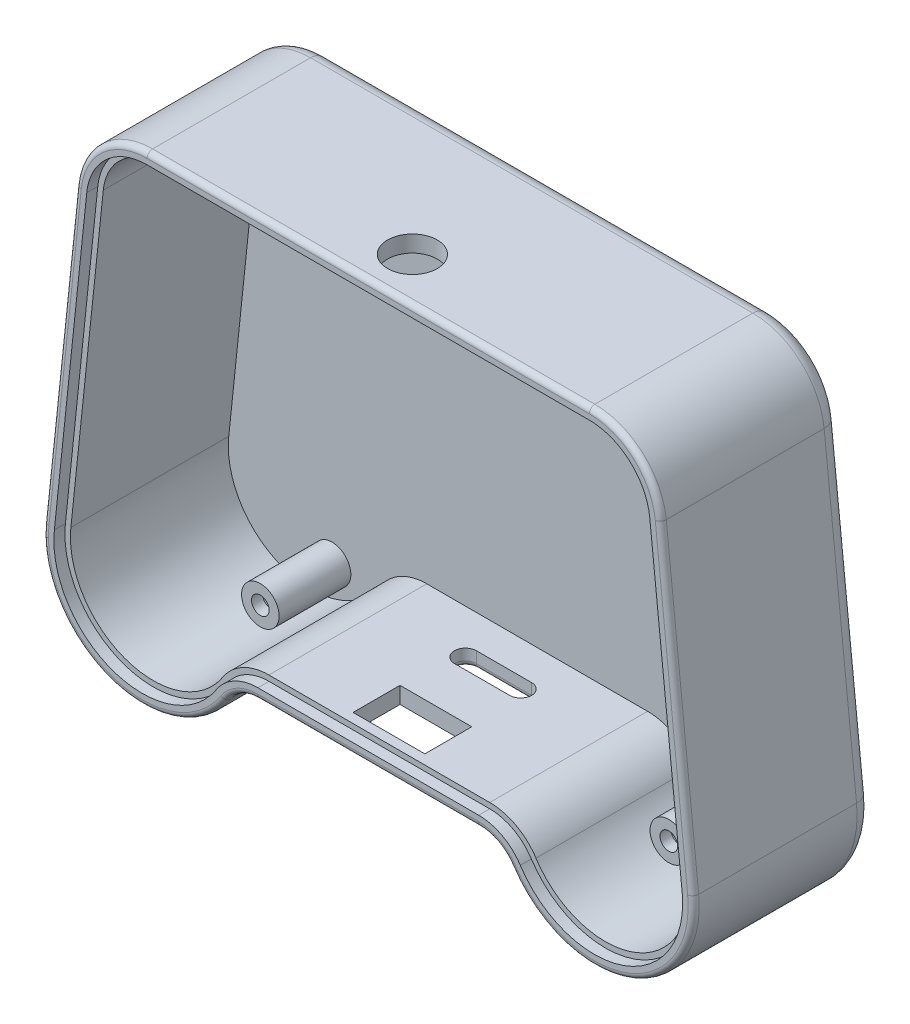
from build123d import *

# Parameters (mm, degrees)
BOSS_EXTRUDE3_DEPTH     = 32.6
CUT_EXTRUDE3_DEPTH      = 2
CUT_EXTRUDE4_DEPTH      = 28.6
FILLET3_R               = 3
SKETCH4_R               = 3.5
BOSS_EXTRUDE4_DEPTH     = 13
SKETCH6_R               = 4.5
CUT_EXTRUDE5_DEPTH      = 13
CUT_EXTRUDE6_DEPTH      = 13
SKETCH12_R              = 1.4
CUT_EXTRUDE7_DEPTH      = 13
SKETCH14_R              = 3.4
BOSS_EXTRUDE6_DEPTH     = 13
SKETCH15_R              = 1.6
CUT_EXTRUDE8_DEPTH      = 14
CUT_EXTRUDE9_DEPTH      = 11
CUT_EXTRUDE9_DEPTH_BACK = 12
SKETCH16_R              = 2.7
SKETCH17_W              = 13
SKETCH17_H              = 8.5
CUT_EXTRUDE10_DEPTH     = 3
FILLET8_R               = 1
FILLET10_R              = 1


with BuildPart() as part:
    # Sketch1 → Boss-Extrude3 (new body)
    with BuildSketch(Plane.XY):
        with BuildLine():
            Line((-52.983565686, 23.39887956), (-58.852264413, -32.438059002))
            ThreePointArc((-58.852264413, -32.438059002), (-46.969286951, -51.283611573), (-25.866243683, -44.140673109))
            ThreePointArc((-25.866243683, -44.140673109), (-23.336523529, -41.806324016), (-20, -40.959990463))
            Line((-20, -40.959990463), (20, -40.959990463))
            ThreePointArc((20, -40.959990463), (23.336523529, -41.806324016), (25.866243683, -44.140673109))
            ThreePointArc((25.866243683, -44.140673109), (46.969286951, -51.283611573), (58.852264413, -32.438059002))
            Line((58.852264413, -32.438059002), (52.983565686, 23.39887956))
            ThreePointArc((52.983565686, 23.39887956), (48.753478929, 31.700892268), (40.054781046, 35.040009537))
            Line((40.054781046, 35.040009537), (-40.054781046, 35.040009537))
            ThreePointArc((-40.054781046, 35.040009537), (-48.753478929, 31.700892268), (-52.983565686, 23.39887956))
        make_face()
    extrude(amount=BOSS_EXTRUDE3_DEPTH)

    # 3DSketch4 → Cut-Extrude3 (cut)
    with BuildSketch(Plane(origin=(40.054781046, 33.040009537, 32.6), x_dir=(-0.7683409363755422, -0.6400407842392195, 0), z_dir=(0, 0, 1))):
        with BuildLine():
            Line((0, 0), (61.551455951, -51.273386947))
            add(Edge.make_bspline(
                [(61.551455951, -51.273386947), (61.588680024, -51.304395219), (61.625904097, -51.335403491), (61.663212744, -51.36630816), (61.83731755, -51.508914621), (62.016897971, -51.644813478), (62.160582396, -51.747925732), (62.55807944, -52.020977095), (62.966999087, -52.276660424), (63.230647039, -52.430511499), (63.838045632, -52.757891972), (64.471528972, -53.033315493), (64.831797516, -53.170851401), (65.563673976, -53.413845335), (66.313334814, -53.592940824), (66.691732278, -53.666220369), (67.453903197, -53.779655887), (68.223309902, -53.82566991), (68.608795977, -53.831816819), (69.379281124, -53.810380979), (70.144687368, -53.721466908), (70.525232677, -53.660359002), (71.280231496, -53.505278822), (72.019494368, -53.285344651), (72.383971709, -53.159224039), (73.100177988, -52.8747957), (73.786007028, -52.526233015), (74.121547561, -52.3373849), (74.668859007, -52.000804779), (75.196911166, -51.631910372), (75.403368477, -51.478016949), (75.703386012, -51.235925261), (75.98511625, -50.974334149), (76.077671715, -50.88569271), (76.169549872, -50.79632907), (76.26142803, -50.70696543)],
                knots=[0, 0, 0, 0, 0, 0, 0.015039156, 0.015039156, 0.015039156, 0.069865084, 0.069865084, 0.069865084, 0.164477785, 0.164477785, 0.164477785, 0.283838101, 0.283838101, 0.283838101, 0.403198418, 0.403198418, 0.403198418, 0.522558734, 0.522558734, 0.522558734, 0.641919051, 0.641919051, 0.641919051, 0.761279367, 0.761279367, 0.761279367, 0.880639684, 0.880639684, 0.880639684, 0.960213228, 0.960213228, 0.960213228, 1, 1, 1, 1, 1, 1], degree=5))
            Line((76.26142803, -50.70696543), (116.508507452, -11.561366307))
            add(Edge.make_bspline(
                [(116.508507452, -11.561366307), (116.642148408, -11.43138283), (116.775789364, -11.301399354), (116.908407575, -11.170401944), (117.300125738, -10.771326116), (117.664229786, -10.344874086), (117.896319562, -10.050898179), (118.453995066, -9.298003634), (118.965465003, -8.515801185), (119.253588228, -8.035549949), (119.788067731, -7.052430105), (120.230514408, -6.022559834), (120.428596315, -5.497706496), (120.778210816, -4.431702221), (121.03419379, -3.340180362), (121.138411668, -2.789330645), (121.298568751, -1.680034852), (121.36070558, -0.560708776), (121.367278883, 0), (121.331455173, 1.120585364), (121.197730642, 2.233659019), (121.106618538, 2.786914222), (120.876345388, 3.884053984), (120.55087582, 4.956837669), (120.364818666, 5.485788432), (119.947013086, 6.526103678), (119.4397319, 7.525838124), (119.164424557, 8.014313828), (118.571880673, 8.965989554), (117.898286997, 9.86212864), (117.542136544, 10.295209684), (116.792946072, 11.129186098), (115.973611798, 11.894373807), (115.547496998, 12.258836381), (114.664548651, 12.949630758), (113.724515961, 13.560427174), (113.24145817, 13.845114311), (112.251718979, 14.371643284), (111.21965113, 14.809635332), (110.694387374, 15.005940261), (109.628104868, 15.352054202), (108.535721707, 15.602948853), (107.984367929, 15.704540642), (106.874061909, 15.859911713), (105.754010824, 15.919454913), (105.193145081, 15.924478387), (104.212429665, 15.888556551), (103.238924733, 15.771911626), (102.823045609, 15.708477515), (102.178914225, 15.591143717), (101.540229972, 15.448316527), (101.313051664, 15.393089045), (101.041764738, 15.320570772), (100.77310042, 15.23932356), (100.728039001, 15.225517494), (100.683002229, 15.211629397), (100.637965456, 15.1977413)],
                knots=[0, 0, 0, 0, 0, 0, 0.021853908, 0.021853908, 0.021853908, 0.065561725, 0.065561725, 0.065561725, 0.131123449, 0.131123449, 0.131123449, 0.196685174, 0.196685174, 0.196685174, 0.262246898, 0.262246898, 0.262246898, 0.327808623, 0.327808623, 0.327808623, 0.393370347, 0.393370347, 0.393370347, 0.458932072, 0.458932072, 0.458932072, 0.524493797, 0.524493797, 0.524493797, 0.590055521, 0.590055521, 0.590055521, 0.655617246, 0.655617246, 0.655617246, 0.72117897, 0.72117897, 0.72117897, 0.786740695, 0.786740695, 0.786740695, 0.852302419, 0.852302419, 0.852302419, 0.917864144, 0.917864144, 0.917864144, 0.967096671, 0.967096671, 0.967096671, 0.994475289, 0.994475289, 0.994475289, 1, 1, 1, 1, 1, 1], degree=5))
            add(Edge.make_bspline(
                [(100.637965456, 15.1977413), (100.569964202, 15.176771591), (100.501962948, 15.155801882), (100.433859748, 15.135181173), (100.196585264, 15.065976794), (99.9556205, 15.009405765), (99.782629052, 14.974530224), (99.33119816, 14.895457118), (98.876764512, 14.839400864), (98.596567776, 14.8146417), (98.001430001, 14.78484619), (97.405271571, 14.807669193), (97.09088395, 14.833932957), (96.464930297, 14.913914197), (95.848011145, 15.046884805), (95.542779817, 15.126741261), (94.940712904, 15.313444095), (94.359315967, 15.554622011), (94.0737058, 15.687592439), (93.606037367, 15.927783438), (93.152063142, 16.195493524), (92.97396226, 16.308040708), (92.713990752, 16.486646356), (92.467357228, 16.682593901), (92.385936541, 16.749373435), (92.305020688, 16.816782184), (92.224102671, 16.884188238), (92.223757547, 16.884475732)],
                knots=[0, 0, 0, 0, 0, 0, 0.03982324, 0.03982324, 0.03982324, 0.13833174, 0.13833174, 0.13833174, 0.295525501, 0.295525501, 0.295525501, 0.471581283, 0.471581283, 0.471581283, 0.647637065, 0.647637065, 0.647637065, 0.823692847, 0.823692847, 0.823692847, 0.941063368, 0.941063368, 0.941063368, 0.999748629, 1, 1, 1, 1, 1, 1], degree=5))
            Line((92.223757547, 16.884475732), (61.491845713, 42.48466963))
            add(Edge.make_bspline(
                [(61.491845713, 42.48466963), (61.411272821, 42.55178819), (61.330699929, 42.61890675), (61.250656963, 42.686638176), (61.013707622, 42.893509657), (60.791066284, 43.11692854), (60.648189687, 43.271760936), (60.302855218, 43.669888292), (59.982112363, 44.086457014), (59.799722254, 44.343338602), (59.457458489, 44.87158542), (59.165038122, 45.430005374), (59.031342223, 45.715782601), (58.789085864, 46.298519489), (58.597314126, 46.899717105), (58.514674232, 47.204183867), (58.384503718, 47.78640496), (58.306269995, 48.377130132), (58.279991286, 48.657188441), (58.253010647, 49.114270807), (58.249210565, 49.572558888), (58.252253231, 49.749004593), (58.264351778, 49.996224988), (58.289553171, 50.242202441), (58.297541785, 50.313014197), (58.30589154, 50.383788806), (58.314240768, 50.454563468), (58.314252994, 50.454667106)],
                knots=[0, 0, 0, 0, 0, 0, 0.058696587, 0.058696587, 0.058696587, 0.176089762, 0.176089762, 0.176089762, 0.352179524, 0.352179524, 0.352179524, 0.528269287, 0.528269287, 0.528269287, 0.704359049, 0.704359049, 0.704359049, 0.861583149, 0.861583149, 0.861583149, 0.960110663, 0.960110663, 0.960110663, 0.999941589, 1, 1, 1, 1, 1, 1], degree=5))
            add(Edge.make_bspline(
                [(58.314252994, 50.454667106), (58.319762306, 50.501368411), (58.325271054, 50.54806978), (58.33069467, 50.594780565), (58.362042992, 50.873600104), (58.384338903, 51.153421054), (58.397607171, 51.38683916), (58.422675866, 52.040818319), (58.421686541, 52.695548402), (58.408928945, 53.116044034), (58.347745738, 54.094601394), (58.205865317, 55.06566424), (58.09957857, 55.616389892), (57.838627215, 56.707244701), (57.485186295, 57.771199186), (57.285639607, 58.295119981), (56.841486096, 59.324185943), (56.308396966, 60.310375186), (56.020410555, 60.791521177), (55.403138155, 61.727457), (54.706434832, 62.605762702), (54.339147497, 63.029427202), (53.568545598, 63.843617863), (52.729577466, 64.587208563), (52.29411722, 64.940452338), (51.393475122, 65.608033565), (50.437851321, 66.194195807), (49.947544377, 66.466227858), (48.944441167, 66.966805176), (47.901360842, 67.377631632), (47.37117908, 67.560141755), (46.296237718, 67.878425017), (45.197551402, 68.101372752), (44.643687953, 68.188788163), (43.52975237, 68.315052919), (42.409063204, 68.343287244), (41.848451541, 68.332928784), (40.729536679, 68.263324585), (39.620924005, 68.096073771), (39.070632783, 67.988291068), (37.980959705, 67.724919785), (36.91886363, 67.366954179), (36.395913122, 67.16491571), (35.368613721, 66.715913268), (34.383330665, 66.179431476), (33.902909427, 65.889771499), (32.969939942, 65.26851489), (32.099581252, 64.565187996), (31.679297993, 64.195028268), (31.002391684, 63.550637069), (30.362659987, 62.866096698), (30.115460795, 62.584707186), (29.761820558, 62.149538628), (29.440095632, 61.692157268), (29.334678033, 61.537257872), (29.230454656, 61.381527307), (29.126225192, 61.225800978), (29.125691224, 61.225003192), (29.125157256, 61.224205405)],
                knots=[0, 0, 0, 0, 0, 0, 0.005511925, 0.005511925, 0.005511925, 0.032887797, 0.032887797, 0.032887797, 0.082115387, 0.082115387, 0.082115387, 0.147670536, 0.147670536, 0.147670536, 0.213225685, 0.213225685, 0.213225685, 0.278780835, 0.278780835, 0.278780835, 0.344335984, 0.344335984, 0.344335984, 0.409891133, 0.409891133, 0.409891133, 0.475446283, 0.475446283, 0.475446283, 0.541001432, 0.541001432, 0.541001432, 0.606556581, 0.606556581, 0.606556581, 0.672111731, 0.672111731, 0.672111731, 0.73766688, 0.73766688, 0.73766688, 0.803222029, 0.803222029, 0.803222029, 0.868777179, 0.868777179, 0.868777179, 0.934332328, 0.934332328, 0.934332328, 0.978035761, 0.978035761, 0.978035761, 0.999887477, 0.999887477, 1, 1, 1, 1, 1, 1], degree=5))
            Line((29.125157256, 61.224205405), (-2.100929377, 14.570182142))
            add(Edge.make_bspline(
                [(-2.100929377, 14.570182142), (-2.17222003, 14.463668769), (-2.243510684, 14.357155396), (-2.313968638, 14.250106363), (-2.520346306, 13.925745307), (-2.704241095, 13.586921438), (-2.818295365, 13.356054744), (-3.08570073, 12.770037221), (-3.317843666, 12.170916487), (-3.442952471, 11.806775242), (-3.661851208, 11.069251845), (-3.812182277, 10.313440041), (-3.870367379, 9.932172897), (-3.953099689, 9.165337844), (-3.969202149, 8.394744703), (-3.960541303, 8.009421594), (-3.909686234, 7.240548267), (-3.791545953, 6.47887266), (-3.715844594, 6.100842763), (-3.531559607, 5.352415738), (-3.28227042, 4.623288158), (-3.141822371, 4.264360759), (-2.830214554, 3.5594018), (-2.458973678, 2.883480638), (-2.258602802, 2.553994581), (-1.873245363, 1.980706781), (-1.44149963, 1.44246274), (-1.242541064, 1.21095489), (-0.917176544, 0.85496729), (-0.576793897, 0.513352592), (-0.449415825, 0.390665276), (-0.2833046, 0.23859724), (-0.111585603, 0.093126719), (-0.074448146, 0.062016544), (-0.037224073, 0.031008272), (0, 0)],
                knots=[0, 0, 0, 0, 0, 0, 0.039786772, 0.039786772, 0.039786772, 0.119360316, 0.119360316, 0.119360316, 0.238720633, 0.238720633, 0.238720633, 0.358080949, 0.358080949, 0.358080949, 0.477441266, 0.477441266, 0.477441266, 0.596801582, 0.596801582, 0.596801582, 0.716161899, 0.716161899, 0.716161899, 0.835522215, 0.835522215, 0.835522215, 0.930134916, 0.930134916, 0.930134916, 0.984960844, 0.984960844, 0.984960844, 1, 1, 1, 1, 1, 1], degree=5))
        make_face()
    extrude(amount=-CUT_EXTRUDE3_DEPTH, mode=Mode.SUBTRACT)

    # 3DSketch5 → Cut-Extrude4 (cut)
    with BuildSketch(Plane(origin=(55.867682585, -32.74197645, 30.6), x_dir=(-0.8681548564924724, 0.49629340631176505, 0), z_dir=(0, 0, 1))):
        with BuildLine():
            Line((0, 0), (32.800763434, -45.554623936))
            add(Edge.make_bspline(
                [(32.800763434, -45.554623936), (32.864191751, -45.642714969), (32.927620068, -45.730806002), (32.991662768, -45.818440357), (33.188592499, -46.080085213), (33.402300072, -46.329258902), (33.551301965, -46.490868905), (33.935382284, -46.883631089), (34.340565698, -47.252804884), (34.591334206, -47.464843875), (35.109551099, -47.869049376), (35.660617814, -48.228844356), (35.943984796, -48.397459769), (36.523142914, -48.710341083), (37.125881999, -48.974143205), (37.431962349, -49.093406096), (38.051640576, -49.306171356), (38.686707438, -49.46797193), (39.006541792, -49.53572788), (39.64899518, -49.644498856), (40.297959056, -49.69971809), (40.622439859, -49.714166728), (41.269890706, -49.717358022), (41.916215802, -49.670420622), (42.237026101, -49.633984016), (42.874364163, -49.53378803), (43.498950878, -49.376561694), (43.808313686, -49.285535785), (44.319134673, -49.116313936), (44.822633845, -48.923063441), (45.021670297, -48.840398188), (45.315233251, -48.705923614), (45.598427808, -48.552375889), (45.692181818, -48.499708451), (45.785550789, -48.446332715), (45.878919759, -48.392956979)],
                knots=[0, 0, 0, 0, 0, 0, 0.037062519, 0.037062519, 0.037062519, 0.111820869, 0.111820869, 0.111820869, 0.223807542, 0.223807542, 0.223807542, 0.336097259, 0.336097259, 0.336097259, 0.448018503, 0.448018503, 0.448018503, 0.559379434, 0.559379434, 0.559379434, 0.670066189, 0.670066189, 0.670066189, 0.779999391, 0.779999391, 0.779999391, 0.889985121, 0.889985121, 0.889985121, 0.963279463, 0.963279463, 0.963279463, 1, 1, 1, 1, 1, 1], degree=5))
            Line((45.878919759, -48.392956979), (115.426425142, -8.63510953))
            add(Edge.make_bspline(
                [(115.426425142, -8.63510953), (115.521500985, -8.580758035), (115.616576829, -8.52640654), (115.711223531, -8.471340484), (115.992182169, -8.302099878), (116.261587435, -8.113621836), (116.436690977, -7.9813399), (116.865535789, -7.638280924), (117.276525777, -7.275915774), (117.515184097, -7.050405456), (117.973313434, -6.581211914), (118.387139108, -6.071044479), (118.582933229, -5.806966798), (118.952573514, -5.262795356), (119.277985175, -4.691743098), (119.429166882, -4.399825913), (119.706462585, -3.806135028), (119.933446172, -3.191187069), (120.03397791, -2.880103219), (120.208940888, -2.252613184), (120.332796631, -1.613242561), (120.381622028, -1.292374071), (120.453010895, -0.648169722), (120.471399422, 0), (120.467391324, 0.323846223), (120.433093929, 0.969346659), (120.346388195, 1.6090646), (120.290743415, 1.926760942), (120.178533191, 2.453270474), (120.035923639, 2.973550976), (119.97283241, 3.180014853), (119.867824829, 3.484808527), (119.744368182, 3.78179409), (119.702111913, 3.879625451), (119.659180498, 3.977171073), (119.616249083, 4.074716696)],
                knots=[0, 0, 0, 0, 0, 0, 0.037391733, 0.037391733, 0.037391733, 0.112013088, 0.112013088, 0.112013088, 0.223996236, 0.223996236, 0.223996236, 0.335918461, 0.335918461, 0.335918461, 0.447938789, 0.447938789, 0.447938789, 0.559298712, 0.559298712, 0.559298712, 0.669884925, 0.669884925, 0.669884925, 0.780188556, 0.780188556, 0.780188556, 0.890178818, 0.890178818, 0.890178818, 0.963611982, 0.963611982, 0.963611982, 1, 1, 1, 1, 1, 1], degree=5))
            Line((119.616249083, 4.074716696), (96.999683947, 55.462422562))
            add(Edge.make_bspline(
                [(96.999683947, 55.462422562), (96.932871808, 55.614228219), (96.86605967, 55.766033877), (96.798157935, 55.917339001), (96.587153638, 56.369884412), (96.346516746, 56.808817342), (96.17491799, 57.096389588), (95.724773982, 57.802246985), (95.235802612, 58.479449331), (94.927856737, 58.873975808), (94.280686468, 59.637685328), (93.569183591, 60.343902985), (93.198156002, 60.682150167), (92.429255519, 61.326096604), (91.609724054, 61.903364658), (91.18869334, 62.174473506), (90.32484313, 62.681230526), (89.421671925, 63.114355097), (88.961179141, 63.31207851), (88.024885515, 63.668706701), (87.062090097, 63.945829796), (86.575242399, 64.064244406), (85.592796323, 64.260286394), (84.59741888, 64.3736934), (84.097643174, 64.409650315), (83.096266823, 64.43989149), (82.095858219, 64.386436242), (81.597057429, 64.338896516), (80.604568181, 64.202415071), (79.626938879, 63.98357576), (79.142958126, 63.853868142), (78.186910214, 63.554482285), (77.259162138, 63.176360911), (76.80343039, 62.968095629), (75.910369614, 62.514106384), (75.058397161, 61.987121769), (74.643610553, 61.706042797), (73.838341226, 61.110071441), (73.085340298, 60.449093434), (72.722860948, 60.103133839), (72.027698708, 59.381680764), (71.396102081, 58.604412919), (71.096535772, 58.202780978), (70.530980215, 57.376043727), (70.033506497, 56.50568176), (69.803358129, 56.060682082), (69.382811596, 55.152106395), (69.047946537, 54.210410137), (68.899637053, 53.732456961), (68.680687305, 52.926624213), (68.502434471, 52.108820803), (68.440547133, 51.780116833), (68.366082372, 51.28455297), (68.325791439, 50.786305063), (68.314880384, 50.619781995), (68.305238703, 50.453159229), (68.295597022, 50.286536463)],
                knots=[0, 0, 0, 0, 0, 0, 0.020736904, 0.020736904, 0.020736904, 0.062436043, 0.062436043, 0.062436043, 0.124931004, 0.124931004, 0.124931004, 0.187534058, 0.187534058, 0.187534058, 0.250005709, 0.250005709, 0.250005709, 0.312516303, 0.312516303, 0.312516303, 0.375015541, 0.375015541, 0.375015541, 0.437517868, 0.437517868, 0.437517868, 0.500019219, 0.500019219, 0.500019219, 0.562520854, 0.562520854, 0.562520854, 0.625022022, 0.625022022, 0.625022022, 0.687524546, 0.687524546, 0.687524546, 0.750022178, 0.750022178, 0.750022178, 0.812537233, 0.812537233, 0.812537233, 0.874993809, 0.874993809, 0.874993809, 0.937488745, 0.937488745, 0.937488745, 0.979132804, 0.979132804, 0.979132804, 1, 1, 1, 1, 1, 1], degree=5))
            add(Edge.make_bspline(
                [(68.295597022, 50.286536463), (68.29021596, 50.193543614), (68.284834898, 50.100550766), (68.278864255, 50.007601649), (68.257507685, 49.730222665), (68.220369928, 49.454014227), (68.189964194, 49.270887341), (68.102822097, 48.814409726), (67.996041291, 48.362937425), (67.923931935, 48.094165117), (67.762009745, 47.562600019), (67.560772997, 47.043926123), (67.450904365, 46.788429492), (67.211146088, 46.28060241), (66.937152589, 45.790698883), (66.790211713, 45.548440495), (66.477495544, 45.072273764), (66.130521908, 44.620172224), (65.947956849, 44.399227817), (65.564154915, 43.966636067), (65.151654508, 43.56213894), (64.936511974, 43.365291561), (64.566889997, 43.049567381), (64.179473304, 42.754501801), (64.0215041, 42.640773015), (63.778806922, 42.477423101), (63.528035379, 42.327885091), (63.443319223, 42.278764835), (63.358300284, 42.230162517), (63.273281345, 42.181560198)],
                knots=[0, 0, 0, 0, 0, 0, 0.046900363, 0.046900363, 0.046900363, 0.140090442, 0.140090442, 0.140090442, 0.280092328, 0.280092328, 0.280092328, 0.41984578, 0.41984578, 0.41984578, 0.562288635, 0.562288635, 0.562288635, 0.706312434, 0.706312434, 0.706312434, 0.852992475, 0.852992475, 0.852992475, 0.950692613, 0.950692613, 0.950692613, 1, 1, 1, 1, 1, 1], degree=5))
            Line((63.273281345, 42.181560198), (28.549036879, 22.330938574))
            add(Edge.make_bspline(
                [(28.549036879, 22.330938574), (28.467854506, 22.284529484), (28.386672134, 22.238120395), (28.305226245, 22.192180424), (28.060855432, 22.05802502), (27.809458974, 21.936376859), (27.639867241, 21.860520951), (27.210866448, 21.681938147), (26.773301915, 21.527815288), (26.507889915, 21.444099603), (25.972812731, 21.294398626), (25.428712206, 21.179474236), (25.155244474, 21.131229681), (24.599937538, 21.053145994), (24.040527444, 21.016090307), (23.75744008, 21.007581856), (23.187319504, 21.010474576), (22.618432233, 21.052617348), (22.333123204, 21.08409658), (21.760967232, 21.168972583), (21.197956683, 21.298347357), (20.91637659, 21.373635571), (20.450974914, 21.513741552), (19.991481816, 21.674863106), (19.809590902, 21.743807617), (19.540163176, 21.856020465), (19.278417468, 21.983865126), (19.191440237, 22.027793276), (19.104749495, 22.072304393), (19.018058753, 22.11681551)],
                knots=[0, 0, 0, 0, 0, 0, 0.047090377, 0.047090377, 0.047090377, 0.140381893, 0.140381893, 0.140381893, 0.280402812, 0.280402812, 0.280402812, 0.419995172, 0.419995172, 0.419995172, 0.562396559, 0.562396559, 0.562396559, 0.706635143, 0.706635143, 0.706635143, 0.853285739, 0.853285739, 0.853285739, 0.950926171, 0.950926171, 0.950926171, 1, 1, 1, 1, 1, 1], degree=5))
            add(Edge.make_bspline(
                [(19.018058753, 22.11681551), (18.869571651, 22.193055784), (18.721084502, 22.269296083), (18.572038865, 22.344391196), (18.122202189, 22.562489724), (17.657329919, 22.749757592), (17.342640432, 22.86319785), (16.547382679, 23.124504806), (15.741799119, 23.344673199), (15.254635051, 23.459362285), (14.273146637, 23.648567661), (13.276725728, 23.747113852), (12.776434478, 23.774542714), (11.7739134, 23.78739158), (10.774448865, 23.719422131), (10.276314259, 23.665011395), (9.285979684, 23.515017409), (8.311500692, 23.281913312), (7.829430154, 23.145027156), (6.877730345, 22.831384598), (5.955542871, 22.439705508), (5.502856257, 22.224813363), (4.616436052, 21.757875742), (3.772087783, 21.218485803), (3.361389155, 20.931356954), (2.564837087, 20.323575115), (1.821794408, 19.651452559), (1.464477617, 19.300117077), (0.779914448, 18.568526587), (0.158802667, 17.782343373), (-0.135206228, 17.376545987), (-0.688768734, 16.541414241), (-1.170676849, 15.662986695), (-1.393207369, 15.213988659), (-1.800384398, 14.298540178), (-2.129771274, 13.35231618), (-2.274665719, 12.872629899), (-2.524190845, 11.902211901), (-2.691734681, 10.914306655), (-2.754893189, 10.417105259), (-2.839697625, 9.418944787), (-2.841094181, 8.417322142), (-2.820981183, 7.91690887), (-2.739102415, 6.917723679), (-2.574026902, 5.928376322), (-2.470653877, 5.437013761), (-2.222811482, 4.465515443), (-1.892875102, 3.520252559), (-1.709039935, 3.054673393), (-1.373321091, 2.289696831), (-0.993006468, 1.543786871), (-0.832079451, 1.250057557), (-0.575701072, 0.820031753), (-0.292697325, 0.408547866), (-0.196173481, 0.272439142), (-0.098658953, 0.137020332), (-0.001150234, 0.001597477), (-0.000575117, 0.000798739), (0, 0)],
                knots=[0, 0, 0, 0, 0, 0, 0.020864429, 0.020864429, 0.020864429, 0.062502813, 0.062502813, 0.062502813, 0.124989369, 0.124989369, 0.124989369, 0.187437818, 0.187437818, 0.187437818, 0.249944754, 0.249944754, 0.249944754, 0.312434264, 0.312434264, 0.312434264, 0.374928667, 0.374928667, 0.374928667, 0.437421713, 0.437421713, 0.437421713, 0.499915225, 0.499915225, 0.499915225, 0.562408454, 0.562408454, 0.562408454, 0.624902658, 0.624902658, 0.624902658, 0.687393765, 0.687393765, 0.687393765, 0.749896261, 0.749896261, 0.749896261, 0.812359674, 0.812359674, 0.812359674, 0.874955049, 0.874955049, 0.874955049, 0.937444366, 0.937444366, 0.937444366, 0.979140707, 0.979140707, 0.979140707, 0.99987697, 0.99987697, 1, 1, 1, 1, 1, 1], degree=5))
        make_face()
    extrude(amount=-CUT_EXTRUDE4_DEPTH, mode=Mode.SUBTRACT)

    # Fillet3
    fillet3_edges = [part.edges().sort_by_distance(p)[0] for p in [
        (-55.91791505, -4.519589721, 0),
        (-46.969286951, -51.283611573, 0),
        (-23.336523529, -41.806324016, 0),
        (0, -40.959990463, 0),
        (23.336523529, -41.806324016, 0),
        (46.969286951, -51.283611573, 0),
        (55.91791505, -4.519589721, 0),
        (48.753478929, 31.700892268, 0),
        (0, 35.040009537, 0),
        (-48.753478929, 31.700892268, 0),
    ]]
    fillet(fillet3_edges, radius=FILLET3_R)

    # Sketch4 → Boss-Extrude4 (add)
    with BuildSketch(Plane.XY.offset(2)):
        with Locations(Location((-43, 25.040009537, 0), (0, 0, 180))):
            Circle(SKETCH4_R)
        with Locations(Location((43, 25.040009537, 0), (0, 0, 180))):
            Circle(SKETCH4_R)
        with Locations(Location((43, -30.959990463, 0), (0, 0, 180))):
            Circle(SKETCH4_R)
    extrude(amount=BOSS_EXTRUDE4_DEPTH)

    # Sketch6 → Cut-Extrude5 (cut)
    with BuildSketch(Plane(origin=(0, 32.040009537, 0), x_dir=(-1, 0, 0), z_dir=(0, -1, 0))):
        with Locations(Location((0, -24.6, 0), (0, 0, 180))):
            Circle(SKETCH6_R)
    extrude(amount=-CUT_EXTRUDE5_DEPTH, mode=Mode.SUBTRACT)

    # Sketch7 → Cut-Extrude6 (cut)
    with BuildSketch(Plane(origin=(0, -37.959990463, 0), x_dir=(1, 0, 0), z_dir=(0, 1, 0))):
        with BuildLine():
            Line((5, -12), (-5, -12))
            ThreePointArc((-5, -12), (-7, -10), (-5, -8))
            Line((-5, -8), (5, -8))
            ThreePointArc((5, -8), (7, -10), (5, -12))
        make_face()
    extrude(amount=-CUT_EXTRUDE6_DEPTH, mode=Mode.SUBTRACT)

    # Sketch12 → Cut-Extrude7 (cut)
    with BuildSketch(Plane.XY.offset(15)):
        with Locations((-43, 25.040009537)):
            Circle(SKETCH12_R)
        with Locations((43, 25.040009537)):
            Circle(SKETCH12_R)
        with Locations((43, -30.959990463)):
            Circle(SKETCH12_R)
    extrude(amount=-CUT_EXTRUDE7_DEPTH, mode=Mode.SUBTRACT)

    # Sketch14 → Boss-Extrude6 (add)
    with BuildSketch(Plane.XY.offset(2)):
        with Locations(Location((-37.15502308, -43.395756122, 0), (0, 0, 180))):
            Circle(SKETCH14_R)
        with Locations(Location((36.84497692, -43.395756122, 0), (0, 0, 180))):
            Circle(SKETCH14_R)
    extrude(amount=BOSS_EXTRUDE6_DEPTH)

    # Sketch15 → Cut-Extrude8 (cut)
    with BuildSketch(Plane.XY.offset(15)):
        with Locations((-37.15502308, -43.395756122)):
            Circle(SKETCH15_R)
        with Locations(Location((36.84497692, -43.395756122, 0), (0, 0, 180))):
            Circle(SKETCH15_R)
    extrude(amount=-CUT_EXTRUDE8_DEPTH, mode=Mode.SUBTRACT)

    # Sketch16 → Cut-Extrude9 (cut, two sides: drawn at the far end of the back side and taken through both)
    with BuildSketch(Plane.XY.offset(2).offset(-CUT_EXTRUDE9_DEPTH_BACK)):
        with Locations(Location((-37.15502308, -43.395756122, 0), (0, 0, 180))):
            Circle(SKETCH16_R)
        with Locations(Location((36.84497692, -43.395756122, 0), (0, 0, 180))):
            Circle(SKETCH16_R)
    extrude(amount=CUT_EXTRUDE9_DEPTH + CUT_EXTRUDE9_DEPTH_BACK, mode=Mode.SUBTRACT)

    # Sketch17 → Cut-Extrude10 (cut)
    with BuildSketch(Plane(origin=(0, -37.959990463, 0), x_dir=(1, 0, 0), z_dir=(0, 1, 0))):
        with Locations((0, -24.6)):
            Rectangle(SKETCH17_W, SKETCH17_H)
    extrude(amount=-CUT_EXTRUDE10_DEPTH, mode=Mode.SUBTRACT)

    # Fillet8
    fillet8_edges = [part.edges().sort_by_distance(p)[0] for p in [
        (48.753478929, 31.700892268, 32.6),
        (55.91791505, -4.519589721, 32.6),
        (46.969286951, -51.283611573, 32.6),
        (23.336523529, -41.806324016, 32.6),
        (0, -40.959990463, 32.6),
        (-23.336523529, -41.806324016, 32.6),
        (-46.969286951, -51.283611573, 32.6),
        (-55.91791505, -4.519589721, 32.6),
        (-48.753478929, 31.700892268, 32.6),
        (0, 35.040009537, 32.6),
    ]]
    fillet(fillet8_edges, radius=FILLET8_R)

    # Fillet10
    fillet10_edges = [part.edges().sort_by_distance(p)[0] for p in [
        (7, -40.959990463, 10),
        (0, -40.959990463, 12),
        (-7, -40.959990463, 10),
        (0, -40.959990463, 8),
    ]]
    fillet(fillet10_edges, radius=FILLET10_R)


solid = part.part
